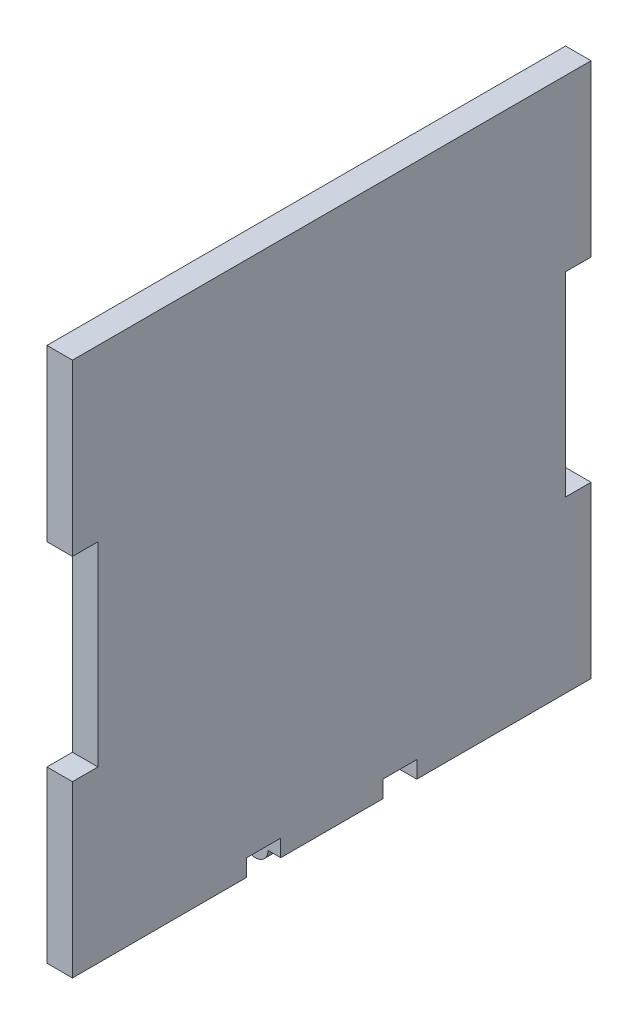
from build123d import *

# Parameters (mm, degrees)
BOSS_EXTRUDE1_DEPTH = 3
SKETCH4_R           = 1.5
BOSS_EXTRUDE2_DEPTH = 3
SKETCH5_W           = 4
SKETCH5_H           = 2
CUT_EXTRUDE1_DEPTH  = 10
LPATTERN1_COUNT     = 2
LPATTERN1_PITCH     = 9


with BuildPart() as part:
    # Sketch1 → Boss-Extrude1 (new body)
    with BuildSketch(Plane(origin=(0, 0, 0), x_dir=(0, 0, -1), z_dir=(1, 0, 0))):
        Polygon((-27.5, 0), (27.5, 0), (30.5, 0), (30.5, 20), (27.5, 20), (27.5, 42.94), (30.5, 42.94), (30.5, 62.94), (27.5, 62.94), (-27.5, 62.94), (-30.5, 62.94), (-30.5, 42.94), (-27.5, 42.94), (-27.5, 20), (-30.5, 20), (-30.5, 0), align=None)
    extrude(amount=BOSS_EXTRUDE1_DEPTH)

    # Sketch4 → Boss-Extrude2 (add)
    with BuildSketch(Plane.XY.offset(3)):
        Circle(SKETCH4_R)
    boss_extrude2 = extrude(amount=BOSS_EXTRUDE2_DEPTH)

    # Sketch5 → Cut-Extrude1 (cut)
    with BuildSketch(Plane.ZY):
        with Locations((-8, 1)):
            Rectangle(SKETCH5_W, SKETCH5_H)
        with Locations((8, 1)):
            Rectangle(SKETCH5_W, SKETCH5_H)
    extrude(amount=-CUT_EXTRUDE1_DEPTH, mode=Mode.SUBTRACT)

    # LPattern1: Boss-Extrude2 ×2
    with Locations(*[(0, 0, -i * LPATTERN1_PITCH) for i in range(1, LPATTERN1_COUNT)]):
        add(boss_extrude2)


solid = part.part
